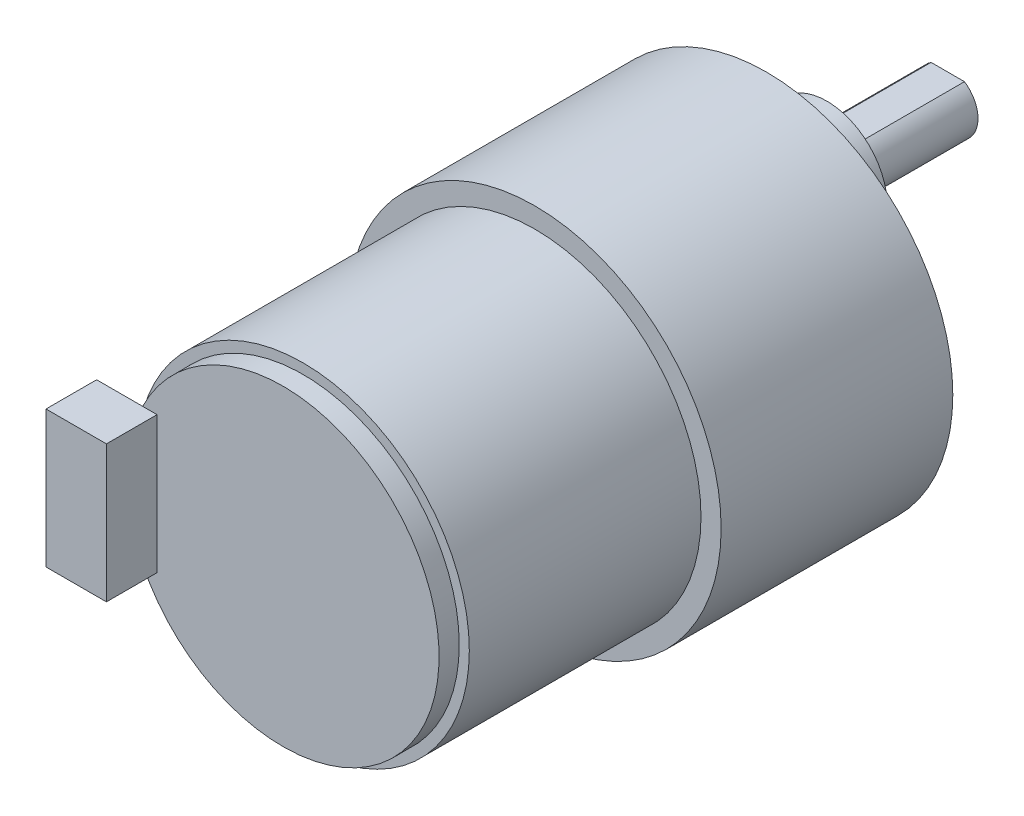
from build123d import *

# Parameters (mm, degrees)
SKETCH1_R           = 16.5
BOSS_EXTRUDE1_DEPTH = 23
SKETCH2_R           = 18.5
BOSS_EXTRUDE2_DEPTH = 23
SKETCH3_R           = 6
BOSS_EXTRUDE3_DEPTH = 6
BOSS_EXTRUDE4_DEPTH = 12
CIRPATTERN1_COUNT   = 6
SKETCH8_R           = 15.5
BOSS_EXTRUDE5_DEPTH = 2
SKETCH10_W          = 6
SKETCH10_H          = 13.585847052
BOSS_EXTRUDE6_DEPTH = 5.02500011


with BuildPart() as part:
    # Sketch1 → Boss-Extrude1 (new body)
    with BuildSketch(Plane.XY):
        Circle(SKETCH1_R)
    extrude(amount=-BOSS_EXTRUDE1_DEPTH)

    # Sketch2 → Boss-Extrude2 (add)
    with BuildSketch(Plane(origin=(0, 0, -23), x_dir=(-1, 0, 0), z_dir=(0, 0, -1))):
        Circle(SKETCH2_R)
    extrude(amount=BOSS_EXTRUDE2_DEPTH)

    # Sketch3 → Boss-Extrude3 (add)
    with BuildSketch(Plane(origin=(0, 0, -46), x_dir=(-1, 0, 0), z_dir=(0, 0, -1))):
        with Locations((0, 7)):
            Circle(SKETCH3_R)
    extrude(amount=BOSS_EXTRUDE3_DEPTH)

    # Sketch4 → Boss-Extrude4 (add)
    with BuildSketch(Plane(origin=(0, 0, -52), x_dir=(-1, 0, 0), z_dir=(0, 0, -1))):
        with BuildLine():
            Line((-1.658312395, 9.5), (1.658312395, 9.5))
            ThreePointArc((1.658312395, 9.5), (0, 4), (-1.658312395, 9.5))
        make_face()
    extrude(amount=BOSS_EXTRUDE4_DEPTH)

    # Sketch7 → M3x0.5 Tapped Hole1 (revolve, cut)
    with BuildSketch(Plane(origin=(-15.5, 0, -46), x_dir=(0, 1, 0), z_dir=(1, 0, 0))):
        Polygon((0, 0), (0, 10.751081174), (1.25, 10.0000054), (1.25, 0.275), (1.525, 0), align=None)
    m3x0_5_tapped_hole1 = revolve(axis=Axis((-15.5, 0, -52.35), (0, 0, 1)), mode=Mode.SUBTRACT)

    # CirPattern1: M3x0.5 Tapped Hole1 ×6 about axis
    cirpattern1_axis = Axis((0, 0, 0), (0, 0, 1))
    for i in range(1, CIRPATTERN1_COUNT):
        add(m3x0_5_tapped_hole1.rotate(cirpattern1_axis, i * 360 / CIRPATTERN1_COUNT), mode=Mode.SUBTRACT)

    # Sketch8 → Boss-Extrude5 (add)
    with BuildSketch(Plane.XY):
        Circle(SKETCH8_R)
    extrude(amount=BOSS_EXTRUDE5_DEPTH)

    # Sketch10 → Boss-Extrude6 (add)
    with BuildSketch(Plane.XY.offset(2)):
        with Locations((-15.5, 0)):
            Rectangle(SKETCH10_W, SKETCH10_H)
    extrude(amount=BOSS_EXTRUDE6_DEPTH)


solid = part.part
